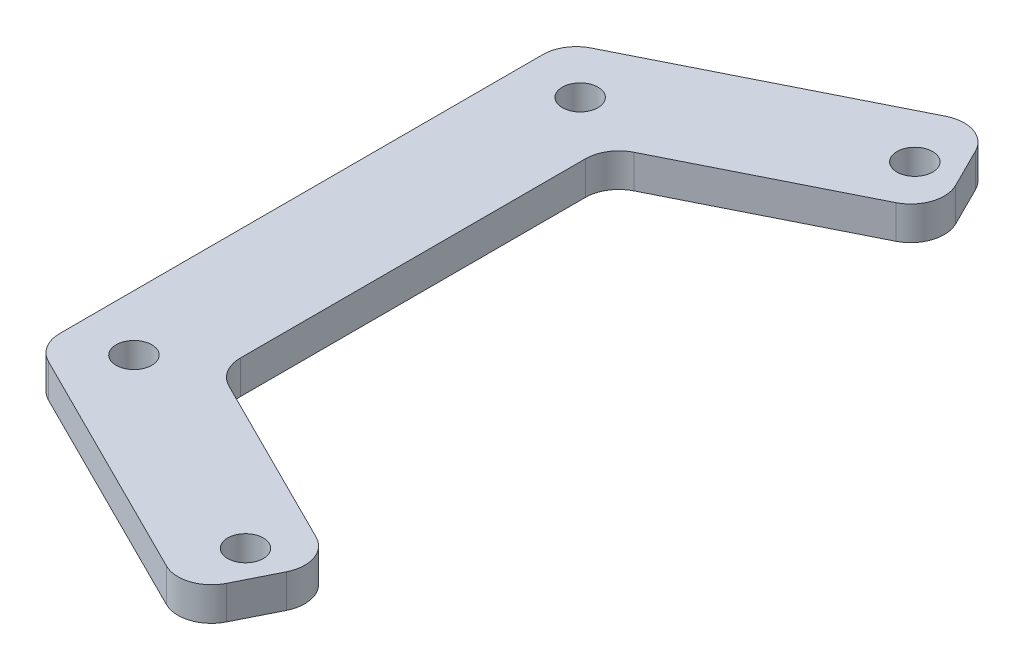
from build123d import *

# Parameters (mm, degrees)
CROQUIS1_R              = 1.6
SALIENTE_EXTRUIR1_DEPTH = 3
REDONDEO1_R             = 3


with BuildPart() as part:
    # Croquis1 → Saliente-Extruir1 (new body)
    with BuildSketch(Plane(origin=(0, 0, 0), x_dir=(1, 0, 0), z_dir=(0, 1, 0))):
        Polygon((-5, 23.5), (-5, -23.5), (20.527864045, -36.263932023), (25, -27.319660113), (5, -17.319660113), (5, 17.319660113), (25, 27.319660113), (20.527864045, 36.263932023), align=None)
        with Locations(Location((0, 20, 0), (0, 0, 270))):
            Circle(CROQUIS1_R, mode=Mode.SUBTRACT)
        with Locations(Location((0, -20, 0), (0, 0, 270))):
            Circle(CROQUIS1_R, mode=Mode.SUBTRACT)
        with Locations(Location((20, 30, 0), (0, 0, 270))):
            Circle(CROQUIS1_R, mode=Mode.SUBTRACT)
        with Locations(Location((20, -30, 0), (0, 0, 270))):
            Circle(CROQUIS1_R, mode=Mode.SUBTRACT)
    extrude(amount=SALIENTE_EXTRUIR1_DEPTH)

    # Redondeo1
    redondeo1_edges = [part.edges().sort_by_distance(p)[0] for p in [
        (25, 1.5, 27.319660113),
        (20.527864045, 1.5, 36.263932023),
        (-5, 1.5, 23.5),
        (-5, 1.5, -23.5),
        (20.527864045, 1.5, -36.263932023),
        (25, 1.5, -27.319660113),
        (5, 1.5, -17.319660113),
        (5, 1.5, 17.319660113),
    ]]
    fillet(redondeo1_edges, radius=REDONDEO1_R)


solid = part.part
